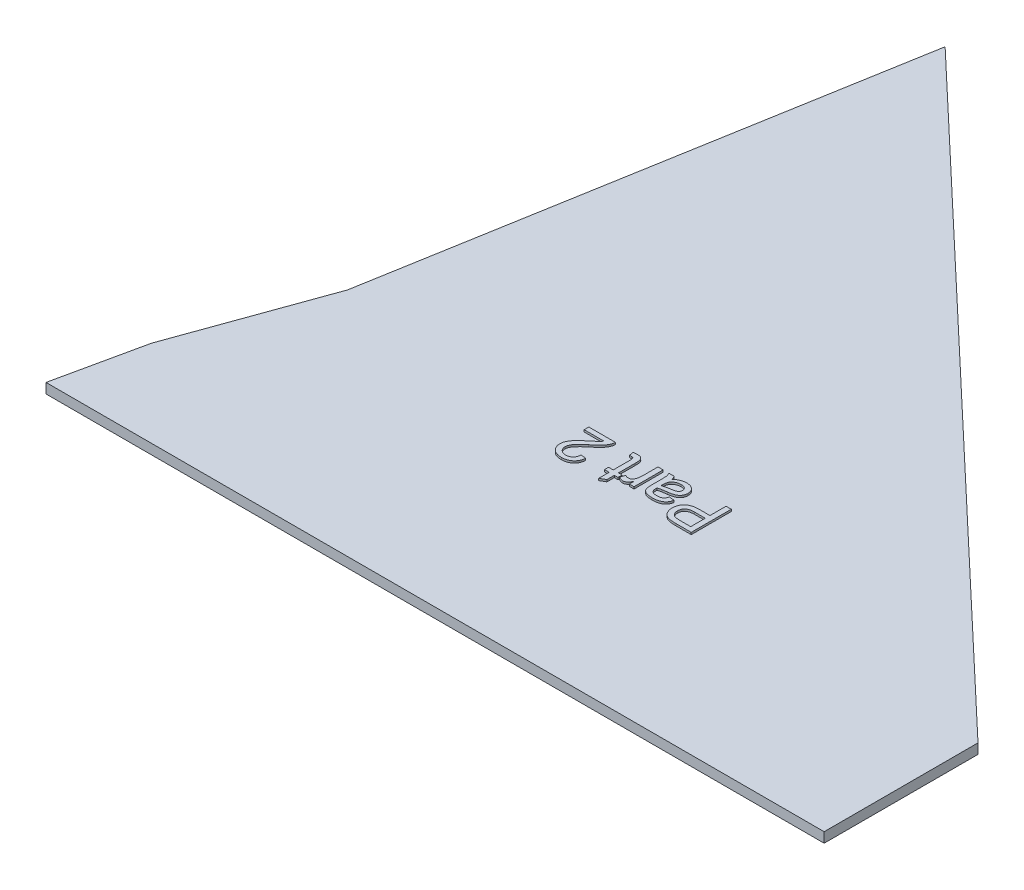
from build123d import *

# Parameters (mm, degrees)
EXTRUDE_2_DEPTH = 1
EXTRUDE_3_DEPTH = 0.2


with BuildPart() as part:
    # 草图1 → 凸台-拉伸2 (new body)
    with BuildSketch(Plane(origin=(0, 0, 0), x_dir=(1, 0, 0), z_dir=(0, 1, 0))):
        Polygon((0.666974339, -2.008736998), (62.551506128, -60.607239608), (62.551506128, -66.034908414), (62.551506128, -67.034908414), (62.551506128, -73.980545843), (62.551506128, -75.980545843), (39.045516138, -75.980545843), (-15.208783188, -75.980545843), (-13.317561286, -67.24653925), (-13.232104006, -67.034908414), (-12.872161474, -66.034908414), (-8.15025235, -52.916400008), align=None)
    extrude(amount=EXTRUDE_2_DEPTH)

    # 草图2 → 凸台-拉伸3 (add)
    # profile 1 of 5: a face of its own
    with BuildSketch(Plane.XZ.offset(-1)):
        with BuildLine():
            Line((15.970736252, 52.916400008), (18.620086901, 52.916400008))
            add(Edge.make_bspline(
                [(18.620086901, 52.916400008), (18.619143914, 52.944292659), (18.617242502, 53.000534556), (18.606807719, 53.085131142), (18.587580404, 53.169951083), (18.561883141, 53.255012969), (18.527915608, 53.339962977), (18.487638241, 53.425479558), (18.438063188, 53.510396662), (18.382742113, 53.597972299), (18.315586256, 53.687411853), (18.23645867, 53.781169052), (18.145666117, 53.88153739), (18.040014931, 53.985444422), (17.923624522, 54.097283146), (17.792661092, 54.212564166), (17.649353118, 54.333882698), (17.548810788, 54.415501615), (17.496710278, 54.457796112)],
                knots=[0, 0, 0, 0, 0.679636028, 1.370397483, 2.072386496, 2.795828244, 3.532596575, 4.299069294, 5.096101743, 5.926104732, 6.821123359, 7.817706802, 8.914074387, 10.116429551, 11.426377678, 12.845587515, 14.365399908, 16, 16, 16, 16], degree=3))
            add(Edge.make_bspline(
                [(17.496710278, 54.457796112), (17.43219033, 54.510624161), (17.304662997, 54.615041794), (17.122871467, 54.777718799), (16.95378538, 54.94524528), (16.820719817, 55.086342813), (16.724256162, 55.201599554), (16.660926505, 55.287362114), (16.609482753, 55.374688641), (16.565335826, 55.460975607), (16.532367635, 55.548243796), (16.507264628, 55.635207105), (16.49334332, 55.722768439), (16.491255162, 55.781074577), (16.490216771, 55.810068839)],
                knots=[0, 0, 0, 0, 1.727365886, 3.414236585, 5.051125997, 6.657366303, 7.42955054, 8.163886393, 8.862711004, 9.526964272, 10.169215867, 10.792073404, 11.3993267, 12, 12, 12, 12], degree=3))
            add(Edge.make_bspline(
                [(16.490216771, 55.810068839), (16.490824427, 55.834453685), (16.492024459, 55.882610255), (16.501980988, 55.953022941), (16.51791102, 56.020431539), (16.542037024, 56.083741901), (16.571201273, 56.144768328), (16.607855975, 56.201911807), (16.650426914, 56.256378889), (16.699780626, 56.306072707), (16.753940548, 56.351348617), (16.811832969, 56.39125657), (16.872968152, 56.425838478), (16.938117127, 56.45336421), (17.006752766, 56.474308694), (17.078373402, 56.489946323), (17.153683925, 56.498834438), (17.205020826, 56.500145014), (17.2312882, 56.500815592)],
                knots=[0, 0, 0, 0, 1.031756814, 2.037571546, 3.00421938, 3.957270543, 4.899734611, 5.862439424, 6.824735417, 7.820853428, 8.820913875, 9.808900714, 10.793363174, 11.788888474, 12.795941292, 13.826998675, 14.888147937, 16, 16, 16, 16], degree=3))
            add(Edge.make_bspline(
                [(17.2312882, 56.500815592), (17.257826755, 56.500149292), (17.309704315, 56.498846807), (17.386073469, 56.489863463), (17.459054082, 56.474315907), (17.529298569, 56.453362446), (17.596077496, 56.425874989), (17.658977398, 56.391082639), (17.719070133, 56.351332489), (17.776187946, 56.306334838), (17.827313024, 56.254165321), (17.87248347, 56.196016077), (17.910692116, 56.131696745), (17.941650968, 56.060998365), (17.965767933, 55.984481008), (17.983717508, 55.902204862), (17.994168004, 55.813851377), (17.995844642, 55.753007878), (17.996710278, 55.721594813)],
                knots=[0, 0, 0, 0, 1.031812441, 2.01698662, 2.984649478, 3.929806142, 4.863654442, 5.786355652, 6.720026173, 7.663072848, 8.607819605, 9.552624931, 10.519658563, 11.508756638, 12.546771345, 13.634199285, 14.778553981, 16, 16, 16, 16], degree=3))
            Line((17.996710278, 55.721594813), (18.516190797, 55.777601307))
            add(Edge.make_bspline(
                [(18.516190797, 55.777601307), (18.511535282, 55.822351126), (18.502419189, 55.909976996), (18.476318181, 56.03659734), (18.440531725, 56.155371936), (18.395137676, 56.265740383), (18.340713345, 56.368547456), (18.275156314, 56.461947186), (18.201030725, 56.548067545), (18.116910951, 56.625000606), (18.025600788, 56.69382396), (17.927529311, 56.753279074), (17.823990461, 56.803720135), (17.714674727, 56.84557891), (17.598989861, 56.876837334), (17.477669551, 56.899467369), (17.350396506, 56.913593449), (17.263522298, 56.915450631), (17.219112875, 56.916400008)],
                knots=[0, 0, 0, 0, 1.12136465, 2.195775393, 3.218105421, 4.210407851, 5.16726023, 6.11240982, 7.049846341, 7.995212629, 8.94920645, 9.896857076, 10.850349768, 11.817681837, 12.811199131, 13.834063315, 14.892789946, 16, 16, 16, 16], degree=3))
            add(Edge.make_bspline(
                [(17.219112875, 56.916400008), (17.171174526, 56.915612323), (17.078009486, 56.914081508), (16.94233579, 56.897967168), (16.814523957, 56.873408157), (16.694733791, 56.837856747), (16.583581809, 56.79127248), (16.480616002, 56.734780273), (16.384913045, 56.669292178), (16.299207083, 56.592542768), (16.223026807, 56.509140615), (16.154284064, 56.422490007), (16.098808949, 56.329563891), (16.050494292, 56.233884087), (16.01552702, 56.132619824), (15.988980352, 56.027913406), (15.973298507, 55.91877019), (15.971598161, 55.844479986), (15.970736252, 55.806822086)],
                knots=[0, 0, 0, 0, 1.226590804, 2.383798815, 3.492161376, 4.554899855, 5.576207927, 6.571155829, 7.556730587, 8.537964122, 9.50843264, 10.446325096, 11.36332231, 12.273967998, 13.185245566, 14.099046289, 15.036401571, 16, 16, 16, 16], degree=3))
            add(Edge.make_bspline(
                [(15.970736252, 55.806822086), (15.971476194, 55.774853272), (15.97296839, 55.710383778), (15.98653324, 55.613667221), (16.008559573, 55.516472527), (16.039724996, 55.419190706), (16.078712733, 55.321385328), (16.12684505, 55.223743163), (16.184325077, 55.126371293), (16.249946275, 55.026175534), (16.329909521, 54.922480401), (16.424723723, 54.811170853), (16.538586247, 54.693407118), (16.667734133, 54.565418016), (16.814765325, 54.429607646), (16.978920553, 54.28494682), (17.16069903, 54.132858689), (17.28847962, 54.029829774), (17.354664823, 53.976464943)],
                knots=[0, 0, 0, 0, 0.647272069, 1.305312805, 1.974061086, 2.663900091, 3.372213675, 4.105057161, 4.866424047, 5.66138998, 6.529516392, 7.516877935, 8.621658815, 9.846264054, 11.199666148, 12.675197319, 14.277886024, 16, 16, 16, 16], degree=3))
            add(Edge.make_bspline(
                [(17.354664823, 53.976464943), (17.389756049, 53.948283214), (17.457455972, 53.893913475), (17.552570953, 53.811392575), (17.639507751, 53.732710163), (17.718344946, 53.657794018), (17.78784884, 53.585090507), (17.848292005, 53.515596274), (17.901397933, 53.449972575), (17.930749767, 53.405272248), (17.944762226, 53.383932476)],
                knots=[0, 0, 0, 0, 1.28638092, 2.481756772, 3.598704207, 4.637980996, 5.589780294, 6.472288135, 7.270675925, 8, 8, 8, 8], degree=3))
            Line((17.944762226, 53.383932476), (15.970736252, 53.383932476))
            Line((15.970736252, 53.383932476), (15.970736252, 52.916400008))
        make_face()
    # profile 2 of 5: a face of its own
    with BuildSketch(Plane.XZ.offset(-1)):
        with BuildLine():
            add(Edge.make_bspline(
                [(20.386320667, 52.906659748), (20.420898759, 52.900100275), (20.486874705, 52.88758462), (20.582268413, 52.874915861), (20.669154507, 52.86585699), (20.724503998, 52.864904118), (20.750768719, 52.864451956)],
                knots=[0, 0, 0, 0, 1.149228166, 2.192758784, 3.142418744, 4, 4, 4, 4], degree=3))
            add(Edge.make_bspline(
                [(20.750768719, 52.864451956), (20.776485264, 52.864661083), (20.826093404, 52.865064496), (20.897613479, 52.871006937), (20.963760253, 52.879780578), (21.024531748, 52.891815814), (21.080378161, 52.907000436), (21.130558725, 52.926545681), (21.175937925, 52.948928932), (21.226858182, 52.984789803), (21.282048119, 53.034463257), (21.333941563, 53.103896178), (21.372082114, 53.180609314), (21.395724633, 53.266934162), (21.407590908, 53.365044254), (21.418787135, 53.477586622), (21.423558434, 53.607381778), (21.424683178, 53.699408739), (21.425281706, 53.748380527)],
                knots=[0, 0, 0, 0, 0.937266869, 1.808021469, 2.614321497, 3.368755705, 4.065183379, 4.720957953, 5.329721901, 5.904281876, 6.986469516, 8.022166564, 9.045578449, 10.09155794, 11.267501064, 12.644549952, 14.21441035, 16, 16, 16, 16], degree=3))
            Line((21.425281706, 53.748380527), (21.425281706, 55.409906501))
            Line((21.425281706, 55.409906501), (21.78891807, 55.409906501))
            Line((21.78891807, 55.409906501), (21.78891807, 55.825490917))
            Line((21.78891807, 55.825490917), (21.425281706, 55.825490917))
            Line((21.425281706, 55.825490917), (21.425281706, 56.560880527))
            Line((21.425281706, 56.560880527), (20.905801187, 56.864451956))
            Line((20.905801187, 56.864451956), (20.905801187, 55.825490917))
            Line((20.905801187, 55.825490917), (20.438268719, 55.825490917))
            Line((20.438268719, 55.825490917), (20.438268719, 55.409906501))
            Line((20.438268719, 55.409906501), (20.905801187, 55.409906501))
            Line((20.905801187, 55.409906501), (20.905801187, 53.729711696))
            add(Edge.make_bspline(
                [(20.905801187, 53.729711696), (20.905491532, 53.696147487), (20.904921044, 53.634311088), (20.897087775, 53.549272244), (20.884267378, 53.479986237), (20.868291908, 53.42307185), (20.836898022, 53.378773602), (20.788054315, 53.350938533), (20.725346902, 53.334302525), (20.678389164, 53.33280714), (20.652554434, 53.331984424)],
                knots=[0, 0, 0, 0, 1.452448426, 2.675891406, 3.688710307, 4.503367039, 5.215361632, 5.972529288, 6.88454679, 8, 8, 8, 8], degree=3))
            add(Edge.make_bspline(
                [(20.652554434, 53.331984424), (20.61900465, 53.331984424), (20.551363957, 53.331984424), (20.483723265, 53.331984424), (20.449632356, 53.331984424)],
                knots=[0, 0, 0, 0, 0.992, 2, 2, 2, 2], degree=3))
            Line((20.449632356, 53.331984424), (20.386320667, 52.906659748))
        make_face()
    # profile 3 of 5: a face of its own
    with BuildSketch(Plane.XZ.offset(-1)):
        with BuildLine():
            Line((21.840866122, 55.71834806), (22.002392096, 55.254062346))
            add(Edge.make_bspline(
                [(22.002392096, 55.254062346), (22.030977438, 55.269982907), (22.086379461, 55.300838978), (22.173279341, 55.333239539), (22.259250855, 55.354082358), (22.316673679, 55.356680309), (22.344924563, 55.35795845)],
                knots=[0, 0, 0, 0, 1.082931093, 2.098857996, 3.064676051, 4, 4, 4, 4], degree=3))
            add(Edge.make_bspline(
                [(22.344924563, 55.35795845), (22.366356586, 55.357171587), (22.408179493, 55.355636086), (22.46872742, 55.343867818), (22.525404594, 55.325664004), (22.577538086, 55.297743806), (22.626197617, 55.263185185), (22.670319613, 55.220151559), (22.710555144, 55.170106332), (22.745786789, 55.112232152), (22.777505979, 55.04782751), (22.804942982, 54.976880882), (22.828419435, 54.900136835), (22.846775405, 54.816980883), (22.862399893, 54.728229012), (22.872802054, 54.63279592), (22.878068817, 54.53144947), (22.87923075, 54.461859994), (22.879827161, 54.426140268)],
                knots=[0, 0, 0, 0, 0.855831978, 1.670088837, 2.45644836, 3.225371139, 4.023460862, 4.833976638, 5.679917449, 6.583000468, 7.535533694, 8.545428253, 9.619328321, 10.739264245, 11.946160008, 13.218911436, 14.572489276, 16, 16, 16, 16], degree=3))
            Line((22.879827161, 54.426140268), (22.879827161, 52.916400008))
            Line((22.879827161, 52.916400008), (23.39930768, 52.916400008))
            Line((23.39930768, 52.916400008), (23.39930768, 55.825490917))
            Line((23.39930768, 55.825490917), (22.931775213, 55.825490917))
            Line((22.931775213, 55.825490917), (22.931775213, 55.375003904))
            Line((22.931775213, 55.375003904), (22.921223265, 55.375003904))
            add(Edge.make_bspline(
                [(22.921223265, 55.375003904), (22.90250755, 55.414638538), (22.866660257, 55.490553048), (22.803177162, 55.593066118), (22.735746092, 55.680548557), (22.663119544, 55.751883402), (22.586412363, 55.808409789), (22.504443093, 55.848062281), (22.418042629, 55.872706415), (22.358612215, 55.87585417), (22.328690797, 55.877438969)],
                knots=[0, 0, 0, 0, 1.276506557, 2.444966941, 3.506508087, 4.487857198, 5.402644978, 6.270166428, 7.129081051, 8, 8, 8, 8], degree=3))
            add(Edge.make_bspline(
                [(22.328690797, 55.877438969), (22.287913673, 55.875605794), (22.205270968, 55.871890511), (22.082383932, 55.839535198), (21.958850983, 55.790073148), (21.88110868, 55.742812224), (21.840866122, 55.71834806)],
                knots=[0, 0, 0, 0, 0.939501361, 1.904080694, 2.915067448, 4, 4, 4, 4], degree=3))
        make_face()
    # profile 4 of 5: a face of its own
    with BuildSketch(Plane.XZ.offset(-1)):
        with BuildLine():
            Line((23.970736252, 52.916400008), (24.490216771, 52.916400008))
            add(Edge.make_bspline(
                [(24.490216771, 52.916400008), (24.508104277, 52.941612159), (24.544942758, 52.993535406), (24.585499143, 53.083848499), (24.622607017, 53.18292137), (24.638047224, 53.254335162), (24.646060927, 53.291400008)],
                knots=[0, 0, 0, 0, 0.903978496, 1.861701424, 2.890190454, 4, 4, 4, 4], degree=3))
            add(Edge.make_bspline(
                [(24.646060927, 53.291400008), (24.686356145, 53.257392964), (24.765620174, 53.190498291), (24.892005422, 53.104367919), (25.019449261, 53.028919474), (25.1510041, 52.970475054), (25.283813702, 52.922034952), (25.419737245, 52.88948097), (25.557974377, 52.86784696), (25.651119072, 52.865588757), (25.698008979, 52.864451956)],
                knots=[0, 0, 0, 0, 1.089286914, 2.142717553, 3.15767242, 4.14639824, 5.114065367, 6.075847107, 7.031363525, 8, 8, 8, 8], degree=3))
            add(Edge.make_bspline(
                [(25.698008979, 52.864451956), (25.73484349, 52.86487426), (25.806537448, 52.865696225), (25.910894163, 52.877883531), (26.00930259, 52.895063243), (26.101659931, 52.920422327), (26.188205972, 52.952787508), (26.268681063, 52.992942768), (26.344247554, 53.03887208), (26.411970883, 53.093579728), (26.473204493, 53.153443277), (26.525841232, 53.218993358), (26.572405801, 53.288102814), (26.608456427, 53.363297978), (26.637134334, 53.442416882), (26.657484519, 53.526218982), (26.669789812, 53.614624874), (26.67127754, 53.675288482), (26.672034953, 53.706172735)],
                knots=[0, 0, 0, 0, 1.216620172, 2.368005272, 3.467709852, 4.515474186, 5.528552914, 6.516295668, 7.48404396, 8.444826962, 9.386953838, 10.308660681, 11.218844643, 12.134633563, 13.056730693, 13.995797328, 14.979646845, 16, 16, 16, 16], degree=3))
            add(Edge.make_bspline(
                [(26.672034953, 53.706172735), (26.671295378, 53.735711316), (26.66983689, 53.793963185), (26.657146185, 53.878979729), (26.638044954, 53.96056233), (26.609385845, 54.037418373), (26.573243847, 54.110590268), (26.529602481, 54.179805691), (26.476628528, 54.244224819), (26.416635281, 54.305855294), (26.345571153, 54.362169995), (26.264081218, 54.414536401), (26.169809476, 54.460390215), (26.064105711, 54.501504264), (25.946873113, 54.537819715), (25.818101041, 54.56929687), (25.677745427, 54.596042543), (25.579846333, 54.609243212), (25.52917781, 54.616075333)],
                knots=[0, 0, 0, 0, 0.872498924, 1.720620716, 2.535170943, 3.344721347, 4.138600393, 4.943834853, 5.75681365, 6.59930027, 7.480948153, 8.430305917, 9.456622844, 10.573255699, 11.779617648, 13.080931191, 14.489210689, 16, 16, 16, 16], degree=3))
            Line((25.52917781, 54.616075333), (25.069762226, 54.685068839))
            add(Edge.make_bspline(
                [(25.069762226, 54.685068839), (25.028587768, 54.692111388), (24.950064451, 54.705542148), (24.838084379, 54.728941183), (24.737662974, 54.755043313), (24.675441068, 54.77643098), (24.646060927, 54.786529878)],
                knots=[0, 0, 0, 0, 1.148822433, 2.19090552, 3.145775892, 4, 4, 4, 4], degree=3))
            add(Edge.make_bspline(
                [(24.646060927, 54.786529878), (24.646199864, 54.818456822), (24.646456593, 54.877451699), (24.648651595, 54.958125896), (24.652663412, 55.02363098), (24.657705987, 55.076733695), (24.668163112, 55.123120141), (24.684415804, 55.167618414), (24.707732548, 55.212582094), (24.736683755, 55.257900887), (24.773150701, 55.302817154), (24.820969062, 55.342095595), (24.87787213, 55.377579684), (24.945230456, 55.407144656), (25.022730247, 55.432752348), (25.11240875, 55.450037701), (25.213992025, 55.460436695), (25.285913514, 55.461365182), (25.323820667, 55.461854553)],
                knots=[0, 0, 0, 0, 1.352390342, 2.498958307, 3.417589155, 4.132656031, 4.755438218, 5.426148164, 6.133458403, 6.896422909, 7.702008864, 8.57217888, 9.503941296, 10.534942635, 11.680192474, 12.954580022, 14.394871946, 16, 16, 16, 16], degree=3))
            add(Edge.make_bspline(
                [(25.323820667, 55.461854553), (25.372081756, 55.460936798), (25.463713696, 55.459194281), (25.593115962, 55.437433138), (25.707571184, 55.404611691), (25.790957471, 55.36293786), (25.849419059, 55.322129536), (25.88830413, 55.285119575), (25.924117646, 55.24260148), (25.956997923, 55.194447613), (25.985004625, 55.139616495), (26.010085595, 55.07933695), (26.032441186, 55.013295301), (26.043125944, 54.966568416), (26.04865833, 54.942374034)],
                knots=[0, 0, 0, 0, 1.754488428, 3.33119665, 4.761009267, 6.073287814, 6.701707133, 7.349574514, 8.020310045, 8.722196594, 9.466521309, 10.256534016, 11.097263129, 12, 12, 12, 12], degree=3))
            Line((26.04865833, 54.942374034), (26.568138849, 55.004062346))
            add(Edge.make_bspline(
                [(26.568138849, 55.004062346), (26.560986782, 55.039409898), (26.547008339, 55.108495334), (26.514618834, 55.207559439), (26.475162975, 55.300049151), (26.427890535, 55.385740072), (26.37317694, 55.464814111), (26.309385837, 55.536128334), (26.238419727, 55.601356029), (26.160155908, 55.660341322), (26.073327289, 55.71145347), (25.97892866, 55.755903657), (25.876994337, 55.79434918), (25.767207616, 55.82489768), (25.649669538, 55.848253066), (25.524689127, 55.864952926), (25.391928131, 55.875948252), (25.300845919, 55.876932772), (25.254015473, 55.877438969)],
                knots=[0, 0, 0, 0, 0.995121737, 1.944927317, 2.871981718, 3.768176624, 4.642811287, 5.521362031, 6.404380574, 7.300917974, 8.222174075, 9.181307321, 10.17903391, 11.226833696, 12.324278523, 13.485482902, 14.707146475, 16, 16, 16, 16], degree=3))
            add(Edge.make_bspline(
                [(25.254015473, 55.877438969), (25.211797341, 55.877001586), (25.130269747, 55.876156953), (25.012157019, 55.868856268), (24.903035397, 55.856677667), (24.802273615, 55.841025486), (24.71034747, 55.819027373), (24.627026554, 55.792508915), (24.551849852, 55.761903418), (24.486005565, 55.724961322), (24.427560824, 55.684626578), (24.37415761, 55.64372469), (24.328062273, 55.599104239), (24.286125529, 55.554503682), (24.251919464, 55.506243173), (24.222143746, 55.457013761), (24.199551404, 55.404707182), (24.176543049, 55.330623309), (24.155970041, 55.229129066), (24.138458495, 55.095962994), (24.128042699, 54.947137727), (24.127083251, 54.842823812), (24.126580408, 54.788153255)],
                knots=[0, 0, 0, 0, 1.367973647, 2.641699044, 3.83258734, 4.925145554, 5.943754658, 6.892017319, 7.756622128, 8.569019077, 9.332592202, 10.056954743, 10.745352397, 11.409424547, 12.037261465, 12.658266172, 13.270733256, 13.877969521, 15.169404919, 16.620144845, 18.228629769, 20, 20, 20, 20], degree=3))
            Line((24.126580408, 54.788153255), (24.126580408, 54.128250657))
            add(Edge.make_bspline(
                [(24.126580408, 54.128250657), (24.126748074, 54.080089401), (24.127069289, 53.987822103), (24.124886939, 53.855794563), (24.123637798, 53.735924457), (24.121156001, 53.628507877), (24.118178591, 53.533518387), (24.113686636, 53.451030167), (24.110404714, 53.380850668), (24.102783866, 53.303760791), (24.088478563, 53.215868085), (24.060792687, 53.114040763), (24.021574722, 53.013489566), (23.98786517, 52.949112225), (23.970736252, 52.916400008)],
                knots=[0, 0, 0, 0, 1.402077777, 2.686099577, 3.844102432, 4.89198882, 5.814117699, 6.610652945, 7.297068948, 7.859036182, 8.865208258, 9.885586107, 10.925597672, 12, 12, 12, 12], degree=3))
        make_face()
        with BuildLine():
            Line((24.646060927, 54.199679229), (24.646060927, 54.370945463))
            add(Edge.make_bspline(
                [(24.646060927, 54.370945463), (24.714037716, 54.350685467), (24.856005532, 54.308372976), (25.082654563, 54.258056168), (25.330125274, 54.210469211), (25.547301681, 54.182862064), (25.71977846, 54.156119691), (25.834375512, 54.123793907), (25.93224337, 54.0822163), (26.012970889, 54.03013413), (26.075835859, 53.967095182), (26.120763659, 53.89412008), (26.147870776, 53.810825256), (26.150952915, 53.752106065), (26.152554434, 53.721594813)],
                knots=[0, 0, 0, 0, 1.446121226, 3.020187841, 4.732247023, 6.583196503, 7.48489336, 8.288294041, 9.004862088, 9.646088731, 10.235252101, 10.804947704, 11.379035372, 12, 12, 12, 12], degree=3))
            add(Edge.make_bspline(
                [(26.152554434, 53.721594813), (26.150780222, 53.690768955), (26.147322317, 53.630689936), (26.117068268, 53.545176061), (26.06909427, 53.468260465), (26.002140521, 53.401060111), (25.917211674, 53.346008152), (25.81475135, 53.307839801), (25.696652769, 53.284068767), (25.612637336, 53.281432606), (25.568138849, 53.280036372)],
                knots=[0, 0, 0, 0, 0.897954492, 1.750096425, 2.616193338, 3.526990211, 4.497948252, 5.548655872, 6.701653948, 8, 8, 8, 8], degree=3))
            add(Edge.make_bspline(
                [(25.568138849, 53.280036372), (25.538078529, 53.280635612), (25.478878396, 53.281815742), (25.391497161, 53.291908195), (25.306791359, 53.30802532), (25.224586002, 53.330941083), (25.144699814, 53.359785666), (25.068395361, 53.397042597), (24.994267018, 53.439049376), (24.923374586, 53.487442934), (24.857619213, 53.544136052), (24.80095476, 53.611216711), (24.75215634, 53.686863023), (24.713672327, 53.772178638), (24.682484203, 53.866218244), (24.661232042, 53.969455692), (24.647933555, 54.081634612), (24.6467011, 54.159324738), (24.646060927, 54.199679229)],
                knots=[0, 0, 0, 0, 0.974054159, 1.91828078, 2.847027565, 3.766160553, 4.68173059, 5.595661213, 6.514794201, 7.441593013, 8.373811142, 9.319299364, 10.277753641, 11.282242768, 12.344374973, 13.483001631, 14.692598504, 16, 16, 16, 16], degree=3))
        make_face(mode=Mode.SUBTRACT)
    # profile 5 of 5: a face of its own
    with BuildSketch(Plane.XZ.offset(-1)):
        with BuildLine():
            Line((30.204502486, 56.916400008), (28.688268719, 56.916400008))
            add(Edge.make_bspline(
                [(28.688268719, 56.916400008), (28.630634846, 56.915875197), (28.519387428, 56.914862185), (28.358548535, 56.908759142), (28.210249529, 56.897038009), (28.072481094, 56.882921899), (27.94293405, 56.858115693), (27.819210227, 56.818759177), (27.700518068, 56.764956297), (27.587569693, 56.697511264), (27.482460508, 56.617289158), (27.391004588, 56.521122322), (27.312835667, 56.411973737), (27.250815497, 56.290438449), (27.201624018, 56.161810781), (27.165561641, 56.028909192), (27.143969846, 55.892755975), (27.141038428, 55.800945299), (27.139567421, 55.754874034)],
                knots=[0, 0, 0, 0, 1.244157682, 2.401527469, 3.473468824, 4.455130815, 5.389799171, 6.315206347, 7.251005401, 8.196559236, 9.149855764, 10.095824383, 11.0504261, 12.037874139, 13.032515979, 14.018598527, 15.005718329, 16, 16, 16, 16], degree=3))
            add(Edge.make_bspline(
                [(27.139567421, 55.754874034), (27.140587088, 55.709628614), (27.14258515, 55.62096924), (27.160321606, 55.491715961), (27.187252103, 55.368787174), (27.227479858, 55.253368308), (27.277973219, 55.144377841), (27.339841359, 55.042382161), (27.413753364, 54.94771844), (27.498144727, 54.859539474), (27.595446654, 54.779903763), (27.706843027, 54.711866589), (27.831302324, 54.654005487), (27.969350287, 54.60723217), (28.120988753, 54.570903332), (28.286089407, 54.545819174), (28.464430689, 54.528835116), (28.58784701, 54.527487377), (28.651742745, 54.526789618)],
                knots=[0, 0, 0, 0, 0.978177196, 1.916759246, 2.816858773, 3.695957288, 4.554717961, 5.410842432, 6.270061616, 7.147502833, 8.04596474, 8.981440044, 9.963234339, 11.008881904, 12.128796686, 13.33146493, 14.618432235, 16, 16, 16, 16], degree=3))
            Line((28.651742745, 54.526789618), (29.685021966, 54.526789618))
            Line((29.685021966, 54.526789618), (29.685021966, 52.916400008))
            Line((29.685021966, 52.916400008), (30.204502486, 52.916400008))
            Line((30.204502486, 52.916400008), (30.204502486, 56.916400008))
        make_face()
        with BuildLine():
            Line((29.685021966, 54.994322086), (28.628203784, 54.994322086))
            add(Edge.make_bspline(
                [(28.628203784, 54.994322086), (28.588962075, 54.995061361), (28.513098817, 54.99649055), (28.402967525, 55.004159305), (28.300779763, 55.018842231), (28.205627527, 55.03877464), (28.118448193, 55.06578506), (28.037899793, 55.096684456), (27.966317224, 55.135887532), (27.900473778, 55.177860376), (27.844210343, 55.228732153), (27.794133746, 55.283646875), (27.752272816, 55.345519566), (27.718512203, 55.413088849), (27.691047756, 55.486118776), (27.673029033, 55.565315304), (27.661351965, 55.650090448), (27.659830443, 55.708566601), (27.65904794, 55.738640268)],
                knots=[0, 0, 0, 0, 1.3506626, 2.611141784, 3.796285978, 4.901204962, 5.9527306, 6.934848657, 7.863795126, 8.757347314, 9.614903967, 10.465506862, 11.310023167, 12.176181001, 13.060025945, 13.98827215, 14.965389641, 16, 16, 16, 16], degree=3))
            add(Edge.make_bspline(
                [(27.65904794, 55.738640268), (27.660605089, 55.778259728), (27.663652283, 55.855791318), (27.687666766, 55.968436501), (27.728023969, 56.073679691), (27.782879466, 56.169934719), (27.847896984, 56.254919142), (27.923062978, 56.32257299), (28.0047187, 56.374244346), (28.097977943, 56.405995302), (28.204704303, 56.425089523), (28.329956835, 56.439604071), (28.477418916, 56.446811551), (28.583014325, 56.448150466), (28.639567421, 56.44886754)],
                knots=[0, 0, 0, 0, 1.018660659, 1.99342392, 2.947462538, 3.907551051, 4.834908788, 5.687573627, 6.497006468, 7.302839678, 8.203828931, 9.283092672, 10.544922364, 12, 12, 12, 12], degree=3))
            Line((28.639567421, 56.44886754), (29.685021966, 56.44886754))
            Line((29.685021966, 56.44886754), (29.685021966, 54.994322086))
        make_face(mode=Mode.SUBTRACT)
    extrude(amount=-EXTRUDE_3_DEPTH)


solid = part.part
